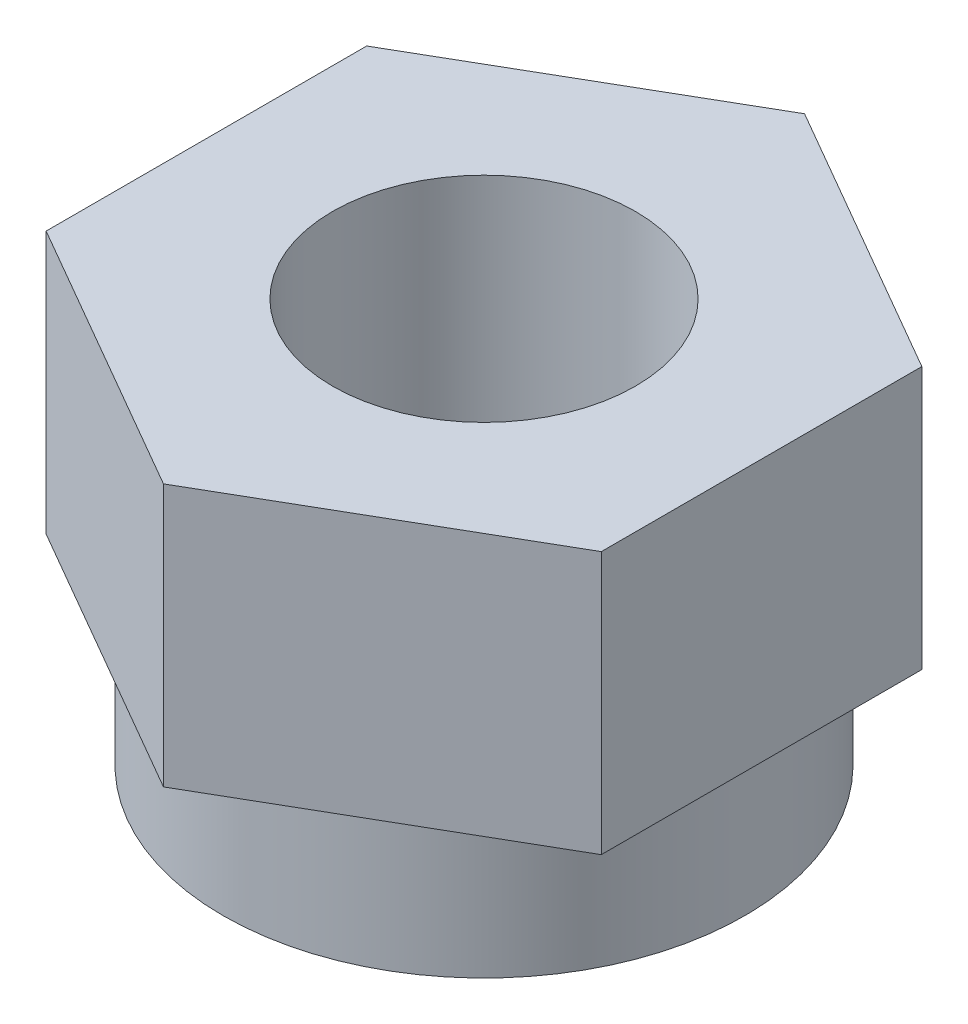
from build123d import *

# Parameters (mm, degrees)
BOSS_EXTRUDE1_DEPTH     = 2.6
SKETCH2_R               = 2.585
BOSS_EXTRUDE2_DEPTH     = 1.4
CUT_EXTRUDE1_DEPTH      = 6.800502852
CUT_EXTRUDE1_DEPTH_BACK = 6.800502852
SKETCH3_R               = 1.5


with BuildPart() as part:
    # Sketch1 → Boss-Extrude1 (new body)
    with BuildSketch(Plane(origin=(0, 0, 0), x_dir=(1, 0, 0), z_dir=(0, 1, 0))):
        Polygon((2.75, -1.58771324), (0, -3.175426481), (-2.75, -1.58771324), (-2.75, 1.58771324), (0, 3.175426481), (2.75, 1.58771324), align=None)
    extrude(amount=-BOSS_EXTRUDE1_DEPTH)

    # Sketch2 → Boss-Extrude2 (add)
    with BuildSketch(Plane(origin=(0, -2.6, 0), x_dir=(1, 0, 0), z_dir=(0, 1, 0))):
        with Locations(Location((0, 0, 0), (0, 0, 270))):
            Circle(SKETCH2_R)
    extrude(amount=-BOSS_EXTRUDE2_DEPTH)

    # Sketch3 → Cut-Extrude1 (cut, two sides: drawn at the far end of the back side and taken through both)
    with BuildSketch(Plane(origin=(0, 0, 0), x_dir=(1, 0, 0), z_dir=(0, 1, 0)).offset(-CUT_EXTRUDE1_DEPTH_BACK)):
        with Locations(Location((0, 0, 0), (0, 0, 270))):
            Circle(SKETCH3_R)
    extrude(amount=CUT_EXTRUDE1_DEPTH + CUT_EXTRUDE1_DEPTH_BACK, mode=Mode.SUBTRACT)


solid = part.part
